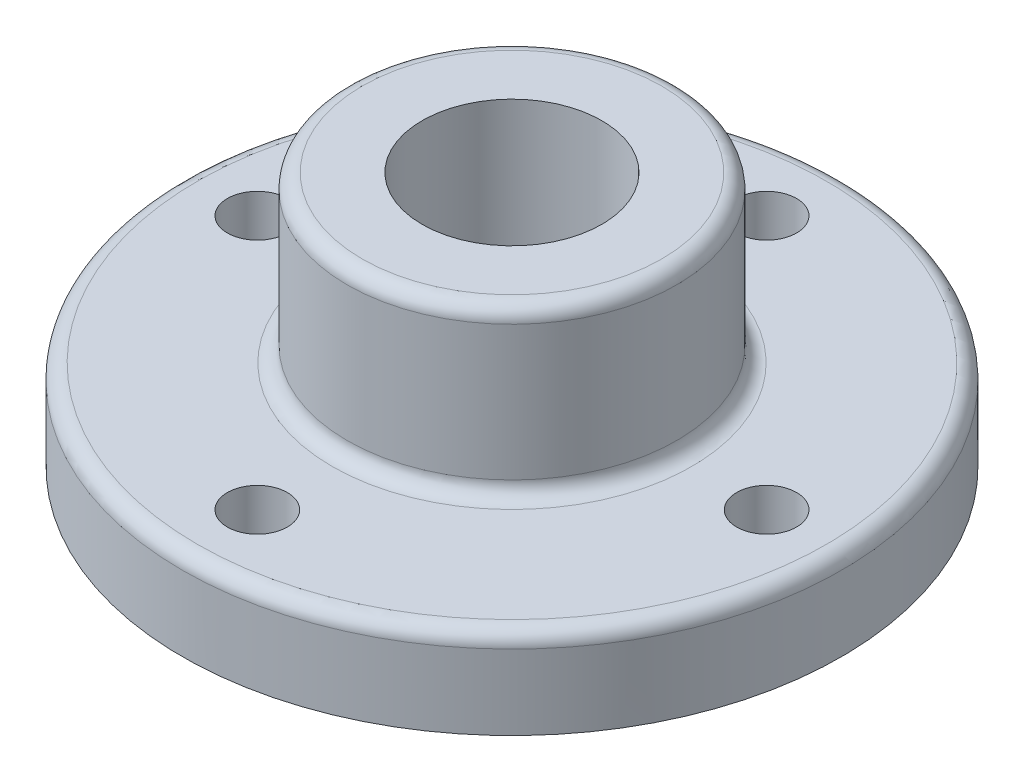
from build123d import *

# Parameters (mm, degrees)
ESQUISSE1_R             = 69.85
BASE_DEPTH              = 19.05
ESQUISSE2_R             = 34.925
DEUXIEME_BASE_DEPTH     = 34.925
ARRONDI_R               = 3.175
ESQUISSE3_R             = 19.05
ENL_V_MAT_EXTRU_1_DEPTH = 76.2
ESQUISSE4_R             = 6.35
ENL_V_MAT_EXTRU_2_DEPTH = 76.2


with BuildPart() as part:
    # Esquisse1 → Base (new body)
    with BuildSketch(Plane(origin=(0, 0, 0), x_dir=(1, 0, 0), z_dir=(0, 1, 0))):
        with Locations(Location((0, 0, 0), (0, 0, 90))):
            Circle(ESQUISSE1_R)
    extrude(amount=BASE_DEPTH)

    # Esquisse2 → Deuxieme base (add)
    with BuildSketch(Plane(origin=(0, 19.05, 0), x_dir=(1, 0, 0), z_dir=(0, 1, 0))):
        with Locations(Location((0, 0, 0), (0, 0, 270))):
            Circle(ESQUISSE2_R)
    extrude(amount=DEUXIEME_BASE_DEPTH)

    # Arrondi
    arrondi_edges = [part.edges().sort_by_distance(p)[0] for p in [
        (0, 19.05, 69.85),
        (0, 19.05, -34.925),
        (0, 53.975, -34.925),
    ]]
    fillet(arrondi_edges, radius=ARRONDI_R)

    # Esquisse3 → Enlèv. mat.-Extru.1 (cut)
    with BuildSketch(Plane(origin=(0, 53.975, 0), x_dir=(1, 0, 0), z_dir=(0, 1, 0))):
        with Locations(Location((0, 0, 0), (0, 0, 270))):
            Circle(ESQUISSE3_R)
    extrude(amount=-ENL_V_MAT_EXTRU_1_DEPTH, mode=Mode.SUBTRACT)

    # Esquisse4 → Enlèv. mat.-Extru.2 (cut)
    with BuildSketch(Plane(origin=(0, 19.05, 0), x_dir=(1, 0, 0), z_dir=(0, 1, 0))):
        with Locations(Location((53.975, 0, 0), (0, 0, 270))):
            Circle(ESQUISSE4_R)
        with Locations(Location((0, 53.975, 0), (0, 0, 270))):
            Circle(ESQUISSE4_R)
        with Locations(Location((-53.975, 0, 0), (0, 0, 270))):
            Circle(ESQUISSE4_R)
        with Locations(Location((0, -53.975, 0), (0, 0, 270))):
            Circle(ESQUISSE4_R)
    extrude(amount=-ENL_V_MAT_EXTRU_2_DEPTH, mode=Mode.SUBTRACT)


solid = part.part
